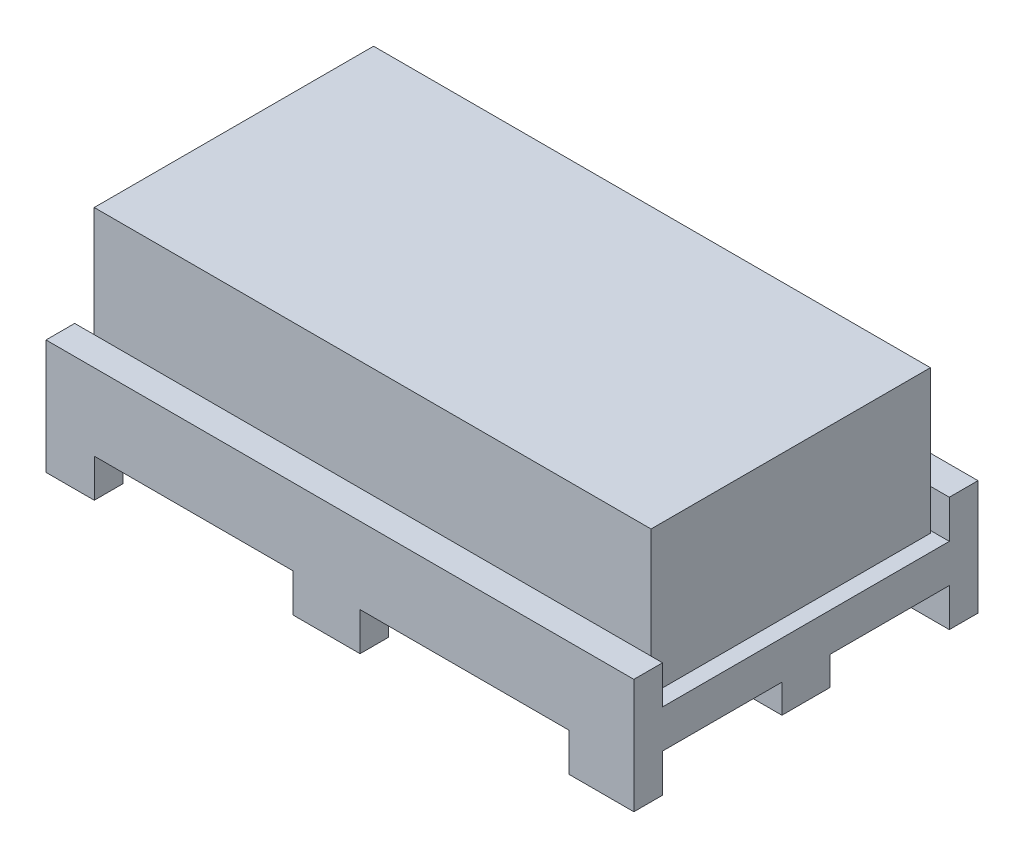
from build123d import *

# Parameters (mm, degrees)
SKETCH1_W               = 104.14
SKETCH1_H               = 3.81
BOSS_EXTRUDE1_DEPTH     = 5.08
BOSS_EXTRUDE1_2_DEPTH   = 5.08
SKETCH2_W               = 104.14
SKETCH2_H               = 45.72
BOSS_EXTRUDE2_DEPTH     = 5.08
SKETCH3_W               = 104.14
SKETCH3_H               = 3.81
BOSS_EXTRUDE3_DEPTH     = 5.08
SKETCH4_W               = 104.14
SKETCH4_H               = 6.3754
BOSS_EXTRUDE4_DEPTH     = 3.81
CUT_EXTRUDE1_DEPTH      = 71.949706835
CUT_EXTRUDE1_DEPTH_BACK = 71.949706835
SKETCH5_W               = 26.368614406
SKETCH5_H               = 5.08
SKETCH5_W_2             = 27.756452018
SKETCH5_W_3             = 30.305435834
SKETCH5_H_2             = 26.045246771
SKETCH6_W               = 73.974469525
SKETCH6_H               = 37.113471059
BOSS_EXTRUDE5_DEPTH     = 19.05


with BuildPart() as part:
    # Sketch1 → Boss-Extrude1 (new body)
    with BuildSketch(Plane(origin=(0, 0, 0), x_dir=(1, 0, 0), z_dir=(0, 1, 0))):
        with Locations((0, -20.955)):
            Rectangle(SKETCH1_W, SKETCH1_H)
    extrude(amount=BOSS_EXTRUDE1_DEPTH)



with BuildPart() as body_2:
    # Sketch1 → Boss-Extrude1 2 (new body)
    with BuildSketch(Plane(origin=(0, 0, 0), x_dir=(1, 0, 0), z_dir=(0, 1, 0))):
        with Locations((0, 20.955)):
            Rectangle(SKETCH1_W, SKETCH1_H)
    extrude(amount=BOSS_EXTRUDE1_2_DEPTH)


with BuildPart() as part_1:
    add(part.part)

    add(body_2.part)  # Boss-Extrude2 merges body 2
    # Sketch2 → Boss-Extrude2 (add)
    with BuildSketch(Plane(origin=(0, 5.08, 0), x_dir=(1, 0, 0), z_dir=(0, 1, 0))):
        Rectangle(SKETCH2_W, SKETCH2_H)
    extrude(amount=BOSS_EXTRUDE2_DEPTH)

    # Sketch3 → Boss-Extrude3 (add)
    with BuildSketch(Plane(origin=(0, 10.16, 0), x_dir=(1, 0, 0), z_dir=(0, 1, 0))):
        with Locations((0, 20.955)):
            Rectangle(SKETCH3_W, SKETCH3_H)
        with Locations((0, -20.955)):
            Rectangle(SKETCH3_W, SKETCH3_H)
    extrude(amount=BOSS_EXTRUDE3_DEPTH)

    # Sketch4 → Boss-Extrude4 (add)
    with BuildSketch(Plane.XZ.offset(-5.08)):
        Rectangle(SKETCH4_W, SKETCH4_H)
    extrude(amount=BOSS_EXTRUDE4_DEPTH)

    # Sketch5 → Cut-Extrude1 (cut, two sides: drawn at the far end of the back side and taken through both)
    with BuildSketch(Plane.XY.offset(22.86).offset(-CUT_EXTRUDE1_DEPTH_BACK)):
        with Locations((-32.471537131, 2.54)):
            Rectangle(SKETCH5_W, SKETCH5_H)
        with Locations((3.530263491, 2.54)):
            Rectangle(SKETCH5_W_2, SKETCH5_H)
        with Locations((41.178408022, 7.587510726)):
            Rectangle(SKETCH5_W_3, SKETCH5_H_2)
    extrude(amount=CUT_EXTRUDE1_DEPTH + CUT_EXTRUDE1_DEPTH_BACK, mode=Mode.SUBTRACT)

    # Sketch6 → Boss-Extrude5 (add)
    with BuildSketch(Plane(origin=(0, 10.16, 0), x_dir=(1, 0, 0), z_dir=(0, 1, 0))):
        with Locations((-13.148391244, 0.168315062)):
            Rectangle(SKETCH6_W, SKETCH6_H)
    extrude(amount=BOSS_EXTRUDE5_DEPTH)


solid = part_1.part
